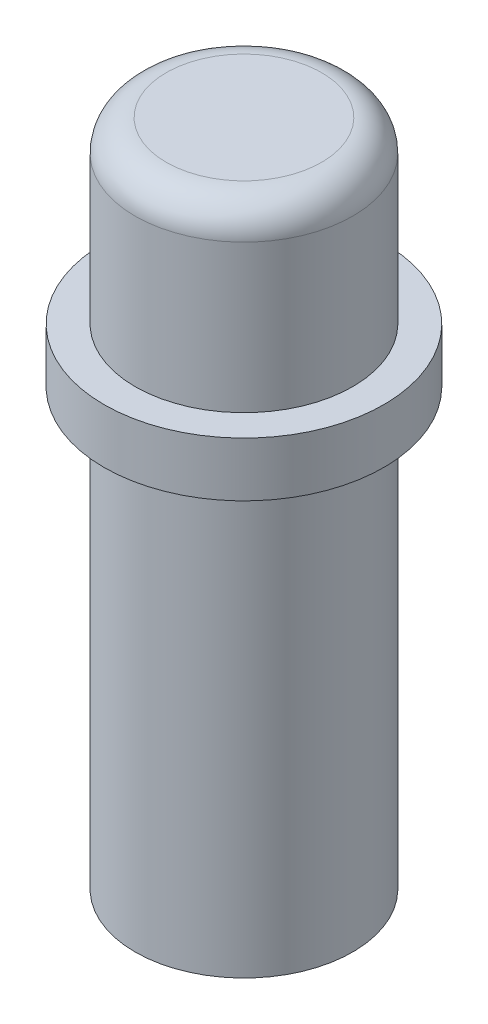
from build123d import *

# Parameters (mm, degrees)
SKETCH1_R           = 3.5
BOSS_EXTRUDE1_DEPTH = 14
BOSS_EXTRUDE2_START = 14
SKETCH1_4_R         = 4.5
BOSS_EXTRUDE2_DEPTH = 1.75
BOSS_EXTRUDE3_START = 15.75
SKETCH1_5_R         = 3.5
BOSS_EXTRUDE3_DEPTH = 5.75
FILLET1_R           = 1
SKETCH2_R           = 2
CUT_EXTRUDE1_DEPTH  = 0.5


with BuildPart() as part:
    # Sketch1 → Boss-Extrude1 (new body)
    with BuildSketch(Plane(origin=(0, 0, 0), x_dir=(1, 0, 0), z_dir=(0, 1, 0))):
        with Locations(Location((0, 0, 0), (0, 0, 270))):
            Circle(SKETCH1_R)
    extrude(amount=BOSS_EXTRUDE1_DEPTH)

    # Sketch1<4> → Boss-Extrude2 (add)
    with BuildSketch(Plane(origin=(0, 0, 0), x_dir=(1, 0, 0), z_dir=(0, 1, 0)).offset(BOSS_EXTRUDE2_START)):
        with Locations(Location((0, 0, 0), (0, 0, 270))):
            Circle(SKETCH1_4_R)
    extrude(amount=BOSS_EXTRUDE2_DEPTH)

    # Sketch1<5> → Boss-Extrude3 (add)
    with BuildSketch(Plane(origin=(0, 0, 0), x_dir=(1, 0, 0), z_dir=(0, 1, 0)).offset(BOSS_EXTRUDE3_START)):
        with Locations(Location((0, 0, 0), (0, 0, 270))):
            Circle(SKETCH1_5_R)
    extrude(amount=BOSS_EXTRUDE3_DEPTH)

    # Fillet1
    fillet1_edges = [part.edges().sort_by_distance(p)[0] for p in [
        (0, 21.5, -3.5),
    ]]
    fillet(fillet1_edges, radius=FILLET1_R)

    # Sketch2 → Cut-Extrude1 (cut)
    with BuildSketch(Plane.XZ):
        with Locations(Location((0, 0, 0), (0, 0, 270))):
            Circle(SKETCH2_R)
    extrude(amount=-CUT_EXTRUDE1_DEPTH, mode=Mode.SUBTRACT)


solid = part.part
